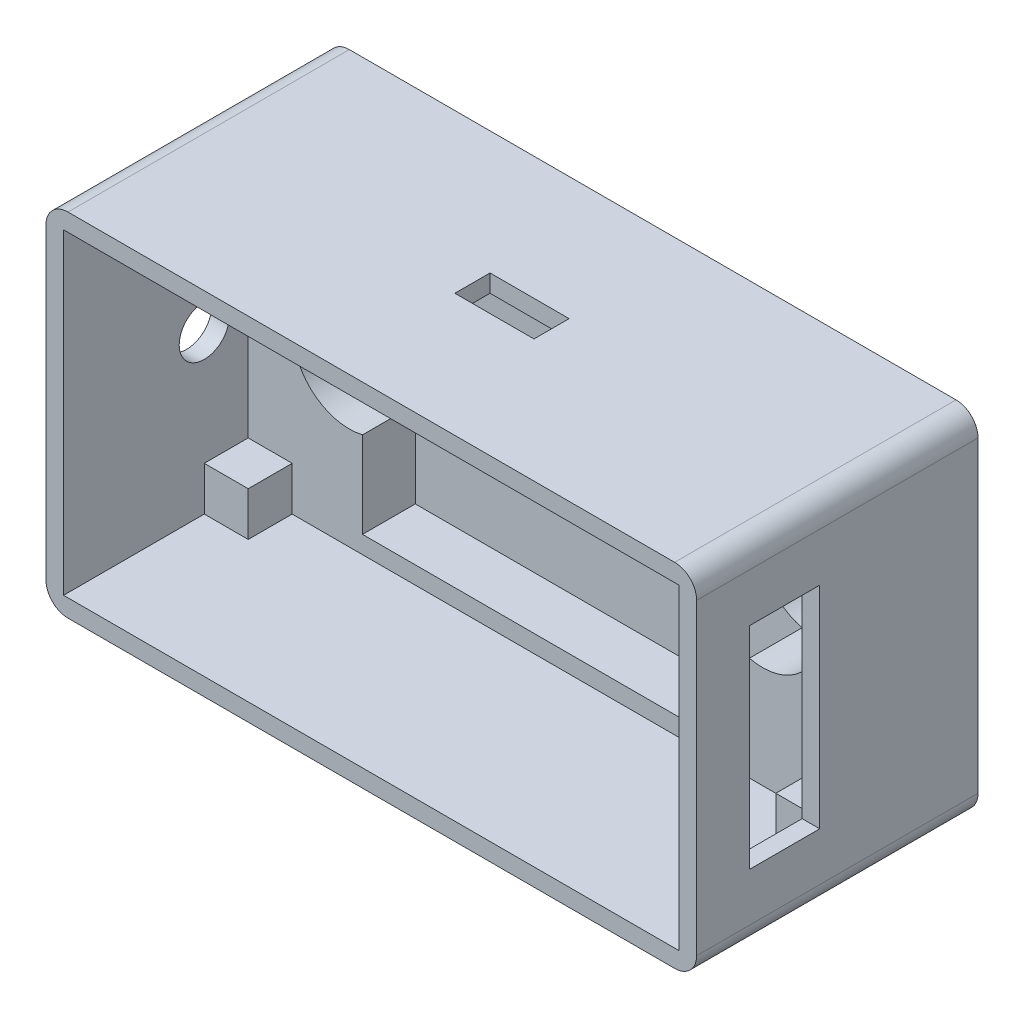
from build123d import *

# Parameters (mm, degrees)
SKETCH1_W               = 74
SKETCH1_H               = 40
BOSS_EXTRUDE1_DEPTH     = 32
SKETCH2_W               = 70
SKETCH2_H               = 36
CUT_EXTRUDE1_DEPTH      = 21
SKETCH3_W               = 44
SKETCH3_H               = 32
CUT_EXTRUDE2_DEPTH      = 6
CUT_EXTRUDE3_DEPTH      = 35
CUT_EXTRUDE3_DEPTH_BACK = 20
SKETCH4_R               = 6.375
SKETCH5_W               = 5
SKETCH5_H               = 5
BOSS_EXTRUDE2_DEPTH     = 5
SKETCH6_W               = 8
SKETCH6_H               = 24
CUT_EXTRUDE4_DEPTH      = 5
SKETCH7_R               = 2.85
CUT_EXTRUDE5_DEPTH      = 5
SKETCH8_W               = 9
SKETCH8_H               = 4
CUT_EXTRUDE6_DEPTH      = 5
FILLET1_R               = 2.5


with BuildPart() as part:
    # Sketch1 → Boss-Extrude1 (new body)
    with BuildSketch(Plane.XY):
        with Locations((37, 20)):
            Rectangle(SKETCH1_W, SKETCH1_H)
    extrude(amount=BOSS_EXTRUDE1_DEPTH)

    # Sketch2 → Cut-Extrude1 (cut)
    with BuildSketch(Plane.XY.offset(32)):
        with Locations((37, 20)):
            Rectangle(SKETCH2_W, SKETCH2_H)
    extrude(amount=-CUT_EXTRUDE1_DEPTH, mode=Mode.SUBTRACT)

    # Sketch3 → Cut-Extrude2 (cut)
    with BuildSketch(Plane.XY.offset(11)):
        with Locations((37, 20)):
            Rectangle(SKETCH3_W, SKETCH3_H)
    extrude(amount=-CUT_EXTRUDE2_DEPTH, mode=Mode.SUBTRACT)

    # Sketch4 → Cut-Extrude3 (cut, two sides: drawn at the far end of the back side and taken through both)
    with BuildSketch(Plane.XY.offset(5).offset(-CUT_EXTRUDE3_DEPTH_BACK)):
        with Locations(Location((13.5, 20, 0), (0, 0, 76.391039369))):
            Circle(SKETCH4_R)
        with Locations(Location((60.5, 20, 0), (0, 0, 103.608960631))):
            Circle(SKETCH4_R)
    extrude(amount=CUT_EXTRUDE3_DEPTH + CUT_EXTRUDE3_DEPTH_BACK, mode=Mode.SUBTRACT)

    # Sketch5 → Boss-Extrude2 (add)
    with BuildSketch(Plane.XY.offset(11)):
        with Locations((4.5, 35.5)):
            Rectangle(SKETCH5_W, SKETCH5_H)
        with Locations((69.5, 36.123202266)):
            Rectangle(SKETCH5_W, SKETCH5_H)
        with Locations((69.5, 4.5)):
            Rectangle(SKETCH5_W, SKETCH5_H)
        with Locations((4.5, 4.5)):
            Rectangle(SKETCH5_W, SKETCH5_H)
    extrude(amount=BOSS_EXTRUDE2_DEPTH)

    # Sketch6 → Cut-Extrude4 (cut)
    with BuildSketch(Plane(origin=(74, 0, 0), x_dir=(0, 0, -1), z_dir=(1, 0, 0))):
        with Locations((-22, 20)):
            Rectangle(SKETCH6_W, SKETCH6_H)
    extrude(amount=-CUT_EXTRUDE4_DEPTH, mode=Mode.SUBTRACT)

    # Sketch7 → Cut-Extrude5 (cut)
    with BuildSketch(Plane.ZY):
        with Locations((16, 20.079680134)):
            Circle(SKETCH7_R)
    extrude(amount=-CUT_EXTRUDE5_DEPTH, mode=Mode.SUBTRACT)

    # Sketch8 → Cut-Extrude6 (cut)
    with BuildSketch(Plane(origin=(0, 40, 0), x_dir=(1, 0, 0), z_dir=(0, 1, 0))):
        with Locations((37, -16)):
            Rectangle(SKETCH8_W, SKETCH8_H)
    extrude(amount=-CUT_EXTRUDE6_DEPTH, mode=Mode.SUBTRACT)

    # Fillet1
    fillet1_edges = [part.edges().sort_by_distance(p)[0] for p in [
        (0, 40, 16),
        (74, 40, 16),
        (74, 0, 16),
        (0, 0, 16),
    ]]
    fillet(fillet1_edges, radius=FILLET1_R)


solid = part.part
